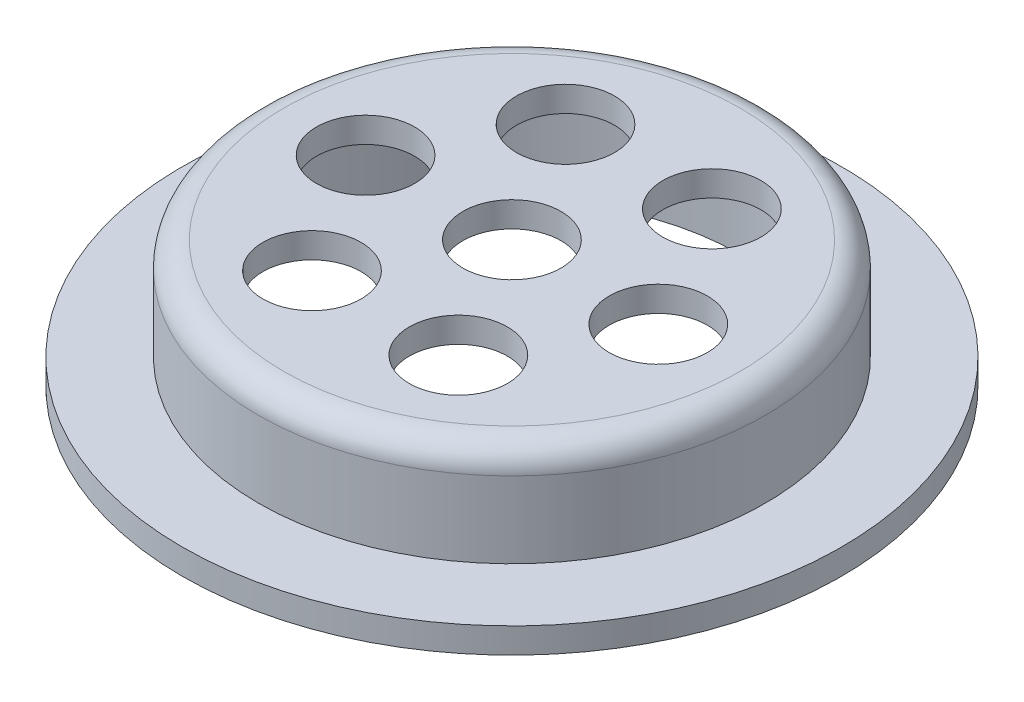
from build123d import *

# Parameters (mm, degrees)
FILLET_3_R          = 0.1
SKETCH_2_R          = 0.193585201
CUT_EXTRUDE_1_DEPTH = 2.905255888


with BuildPart() as part:
    # 草图1 → 旋转1 (revolve)
    with BuildSketch(Plane.XY, mode=Mode.PRIVATE) as revolve_1_sk:
        Polygon((0, 0.8), (1, 0.8), (1, 0.4), (1.3, 0.4), (1.3, 0.3), (0.9, 0.3), (0.9, 0.7), (0, 0.7), align=None)
    revolve(revolve_1_sk.sketch.rotate(Axis((0, 2.362244898, 0), (0, -1, 0)), 90), axis=Axis((0, 2.362244898, 0), (0, -1, 0)))

    # 圆角3
    fillet_3_edges = [part.edges().sort_by_distance(p)[0] for p in [
        (0, 0.8, -1),
    ]]
    fillet(fillet_3_edges, radius=FILLET_3_R)

    # 草图2 → 切除-拉伸1 (cut, through all)
    with BuildSketch(Plane(origin=(0, 0.8, 0), x_dir=(1, 0, 0), z_dir=(0, 1, 0))):
        with Locations(Location((0, 0, 0), (0, 0, 270))):
            Circle(SKETCH_2_R)
        with Locations(Location((-0.288675135, 0.5, 0), (0, 0, 270))):
            Circle(SKETCH_2_R)
        with Locations(Location((0.288675135, 0.5, 0), (0, 0, 270))):
            Circle(SKETCH_2_R)
        with Locations(Location((0.577350269, 0, 0), (0, 0, 270))):
            Circle(SKETCH_2_R)
        with Locations(Location((0.288675135, -0.5, 0), (0, 0, 270))):
            Circle(SKETCH_2_R)
        with Locations(Location((-0.288675135, -0.5, 0), (0, 0, 270))):
            Circle(SKETCH_2_R)
        with Locations(Location((-0.577350269, 0, 0), (0, 0, 270))):
            Circle(SKETCH_2_R)
    extrude(amount=-CUT_EXTRUDE_1_DEPTH, mode=Mode.SUBTRACT)


solid = part.part
